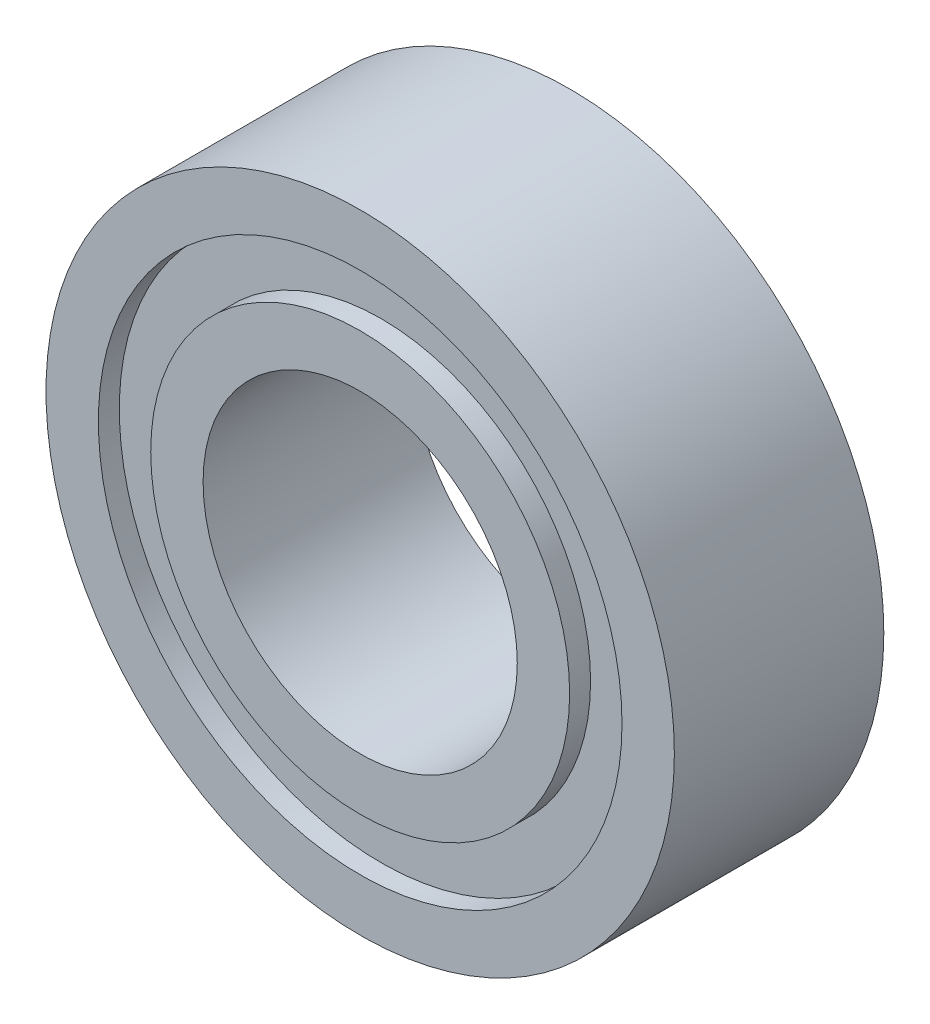
from build123d import *

# Parameters (mm, degrees)
SKETCH2_R           = 4.7625
SKETCH2_R_2         = 2.38125
BOSS_EXTRUDE1_DEPTH = 3.175
SKETCH3_R           = 3.96875
SKETCH3_R_2         = 3.175
CUT_EXTRUDE1_DEPTH  = 0.3175
CUT_EXTRUDE2_START  = -0.635
SKETCH4_R           = 3.96875
SKETCH4_R_2         = 3.175
CUT_EXTRUDE2_DEPTH  = 0.635


with BuildPart() as part:
    # Sketch2 → Boss-Extrude1 (new body)
    with BuildSketch(Plane.XY):
        Circle(SKETCH2_R)
        Circle(SKETCH2_R_2, mode=Mode.SUBTRACT)
    extrude(amount=BOSS_EXTRUDE1_DEPTH)

    # Sketch3 → Cut-Extrude1 (cut)
    with BuildSketch(Plane.XY.offset(3.175)):
        Circle(SKETCH3_R)
        Circle(SKETCH3_R_2, mode=Mode.SUBTRACT)
    extrude(amount=-CUT_EXTRUDE1_DEPTH, mode=Mode.SUBTRACT)

    # Sketch4 → Cut-Extrude2 (cut)
    with BuildSketch(Plane(origin=(0, 0, 0), x_dir=(-1, 0, 0), z_dir=(0, 0, -1)).offset(CUT_EXTRUDE2_START)):
        with Locations(Location((0, 0, 0), (0, 0, 180))):
            Circle(SKETCH4_R)
        with Locations(Location((0, 0, 0), (0, 0, 180))):
            Circle(SKETCH4_R_2, mode=Mode.SUBTRACT)
    extrude(amount=CUT_EXTRUDE2_DEPTH, mode=Mode.SUBTRACT)


solid = part.part
